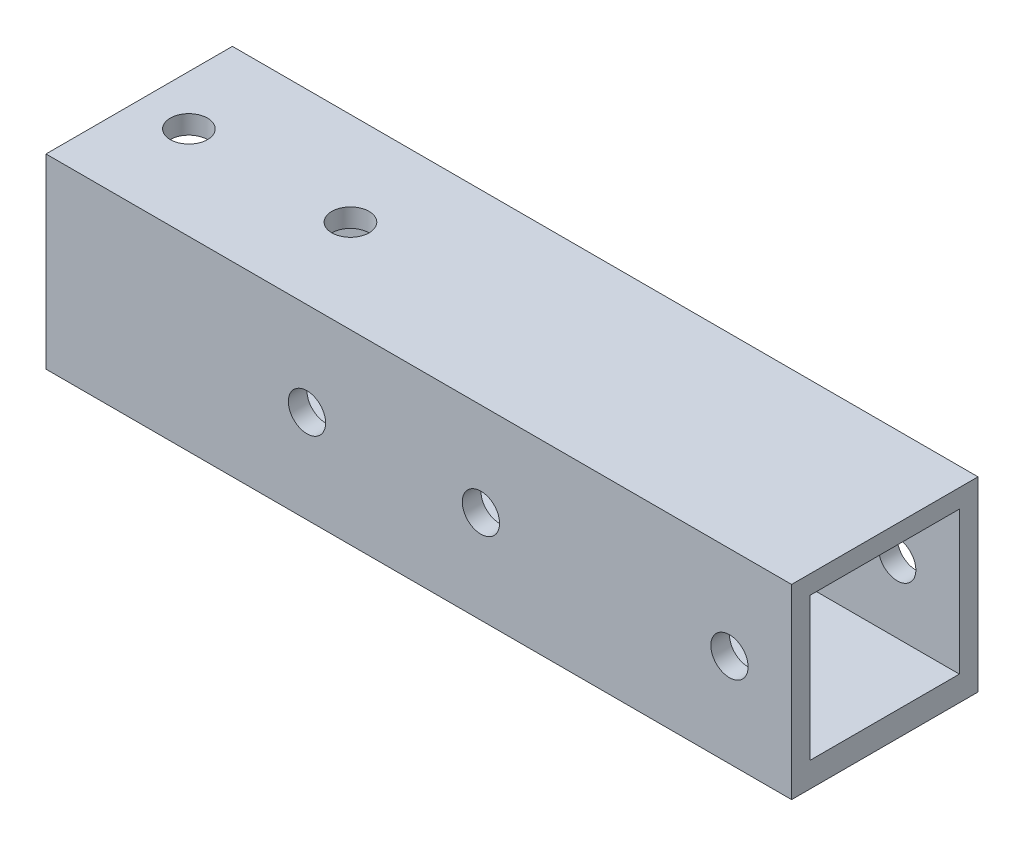
from build123d import *

# Parameters (mm, degrees)
MEMBER_15_15_1_5_1_DEPTH = 60
SKETCH_3_R               = 1.5
CUT_EXTRUDE_1_DEPTH      = 63.299678972
SKETCH_5_R               = 1.5
CUT_EXTRUDE_2_DEPTH      = 63.299678972
SKETCH_6_R               = 1.5
CUT_EXTRUDE_3_DEPTH      = 63.299678972


with BuildPart() as part:
    # Sketch1 → Member 15 _15_ 1.5_1 (new body)
    with BuildSketch(Plane.YZ):
        Polygon((-6, -7.5), (6, -7.5), (7.5, -7.5), (7.5, -6), (7.5, 6), (7.5, 7.5), (6, 7.5), (-6, 7.5), (-7.5, 7.5), (-7.5, 6), (-7.5, -6), (-7.5, -7.5), align=None)
        Polygon((-4, -6), (4, -6), (6, -6), (6, -3.5), (6, 3.5), (6, 6), (3.5, 6), (-3.5, 6), (-5.5, 6), (-5.5, 3.5), (-5.5, -3.5), (-5.5, -6), align=None, mode=Mode.SUBTRACT)
    extrude(amount=MEMBER_15_15_1_5_1_DEPTH)

    # 草图3 → 切除-拉伸1 (cut, through all)
    with BuildSketch(Plane(origin=(0, 7.5, 0), x_dir=(1, 0, 0), z_dir=(0, 1, 0))):
        with Locations(Location((17, 0, 0), (0, 0, 270))):
            Circle(SKETCH_3_R)
        with Locations(Location((4, 0, 0), (0, 0, 270))):
            Circle(SKETCH_3_R)
    extrude(amount=-CUT_EXTRUDE_1_DEPTH, mode=Mode.SUBTRACT)

    # 草图5 → 切除-拉伸2 (cut, through all)
    with BuildSketch(Plane.XY.offset(7.5)):
        with Locations((55, 0)):
            Circle(SKETCH_5_R)
        with Locations((35, 0)):
            Circle(SKETCH_5_R)
    extrude(amount=-CUT_EXTRUDE_2_DEPTH, mode=Mode.SUBTRACT)

    # 草图6 → 切除-拉伸3 (cut, through all)
    with BuildSketch(Plane(origin=(0, 0, -7.5), x_dir=(-1, 0, 0), z_dir=(0, 0, -1))):
        with Locations((-21, 0)):
            Circle(SKETCH_6_R)
    extrude(amount=-CUT_EXTRUDE_3_DEPTH, mode=Mode.SUBTRACT)


solid = part.part
